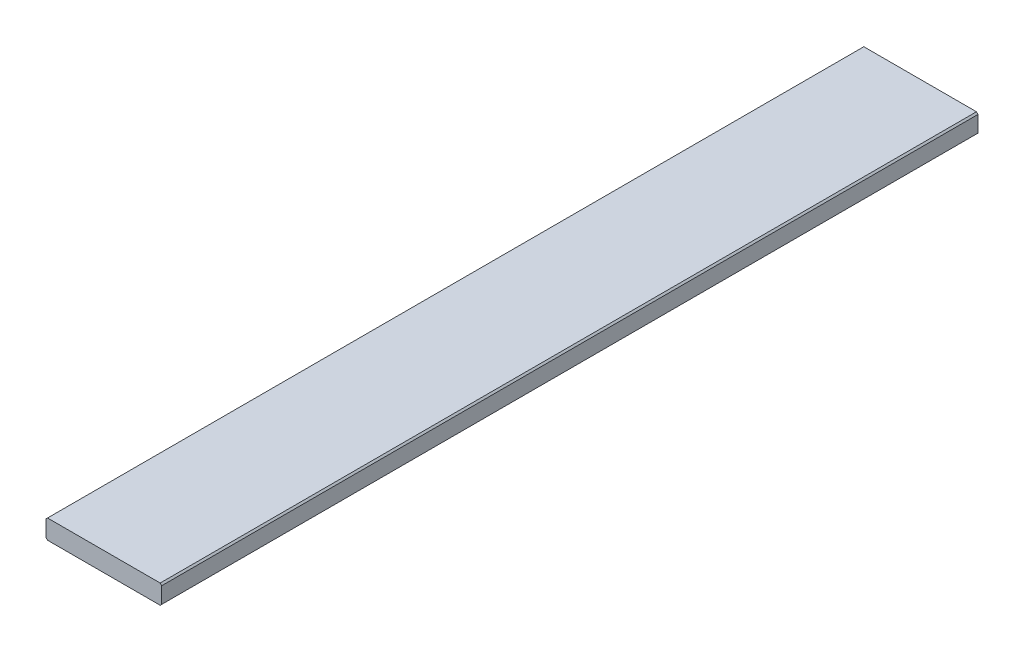
from build123d import *

# Parameters (mm, degrees)
EXTRUDE_1_DEPTH = 1058


with BuildPart() as part:
    # Эскиз1 → Бобышка-Вытянуть1 (new body)
    with BuildSketch(Plane.XY):
        Polygon((-75, 10.5), (-73, 12.5), (73, 12.5), (75, 10.5), (75, -10.5), (73, -12.5), (-73, -12.5), (-75, -10.5), align=None)
    extrude(amount=EXTRUDE_1_DEPTH)


solid = part.part
